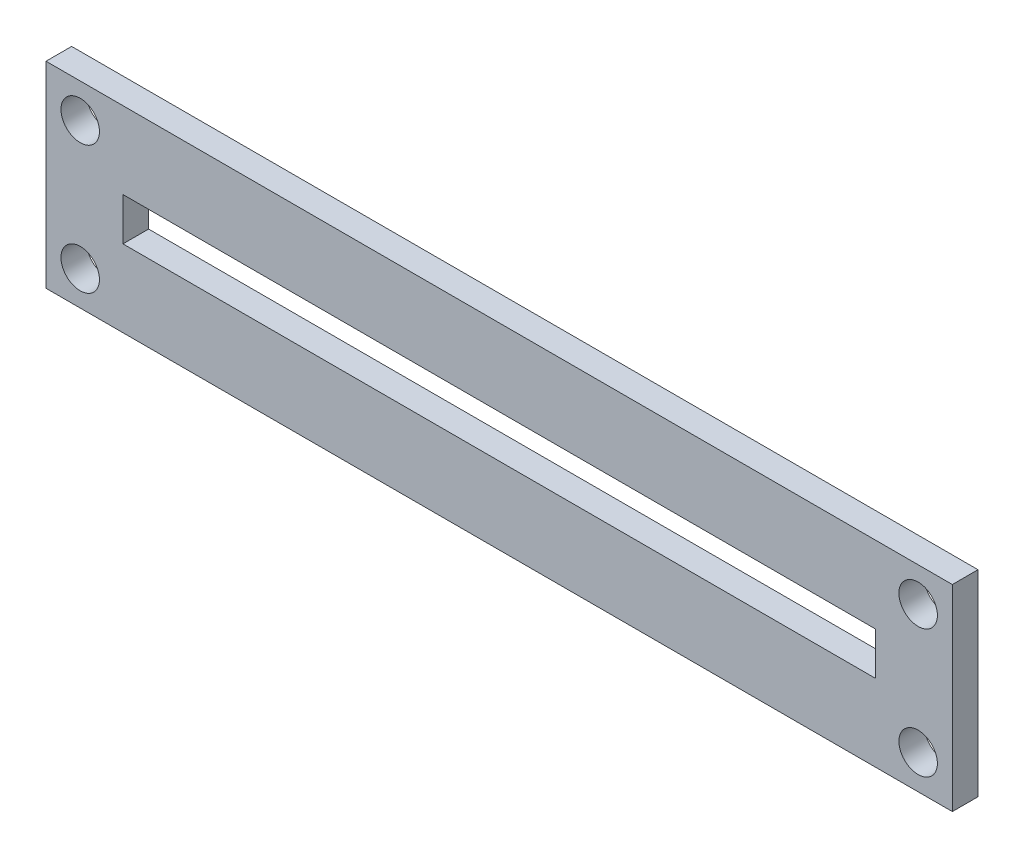
from build123d import *

# Parameters (mm, degrees)
SKETCH1_W           = 106
SKETCH1_H           = 23
SKETCH1_R           = 2.25
SKETCH1_W_2         = 88
SKETCH1_H_2         = 5
BOSS_EXTRUDE1_DEPTH = 3


with BuildPart() as part:
    # Sketch1 → Boss-Extrude1 (new body)
    with BuildSketch(Plane.XY):
        Rectangle(SKETCH1_W, SKETCH1_H)
        with Locations((-49, 7.5)):
            Circle(SKETCH1_R, mode=Mode.SUBTRACT)
        with Locations((-49, -7.5)):
            Circle(SKETCH1_R, mode=Mode.SUBTRACT)
        with Locations((49, 7.5)):
            Circle(SKETCH1_R, mode=Mode.SUBTRACT)
        with Locations((49, -7.5)):
            Circle(SKETCH1_R, mode=Mode.SUBTRACT)
        Rectangle(SKETCH1_W_2, SKETCH1_H_2, mode=Mode.SUBTRACT)
    extrude(amount=BOSS_EXTRUDE1_DEPTH)


solid = part.part
